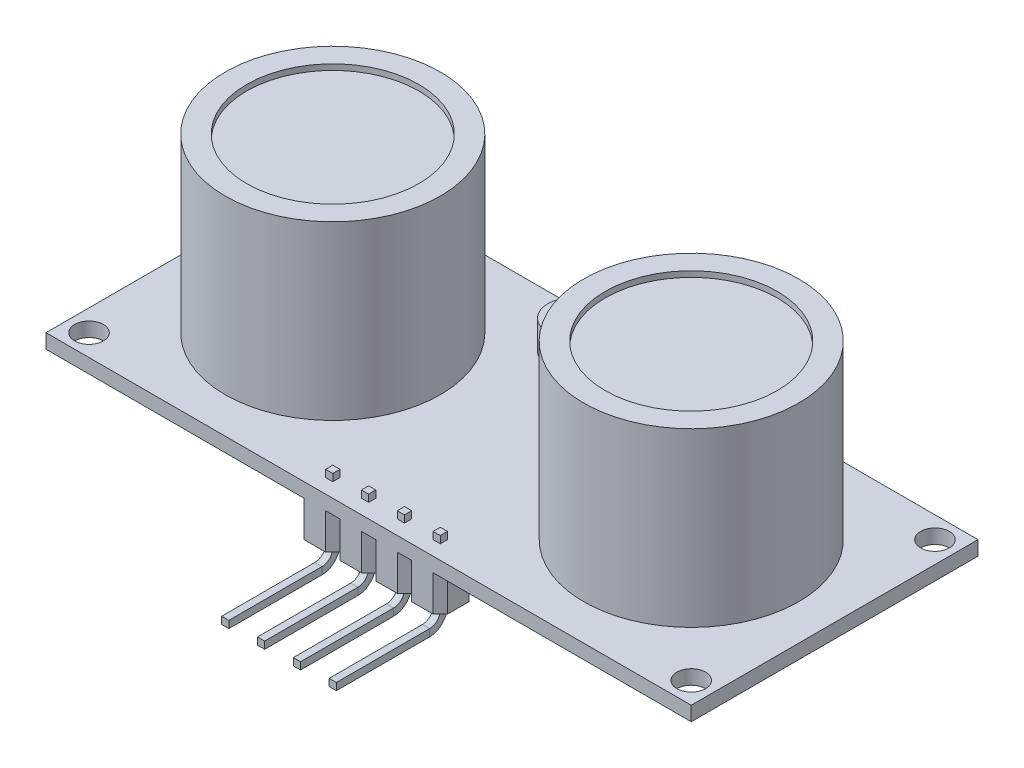
from build123d import *

# Parameters (mm, degrees)
SKETCH1_W           = 45
SKETCH1_H           = 20
BOSS_EXTRUDE1_DEPTH = 1
SKETCH2_R           = 7.5
SKETCH2_R_2         = 6
BOSS_EXTRUDE2_DEPTH = 12
BOSS_EXTRUDE3_DEPTH = 2
BOSS_EXTRUDE4_START = -0.5
SKETCH4_R           = 6
BOSS_EXTRUDE4_DEPTH = 0.1
SKETCH9_W           = 0.5
SKETCH9_H           = 0.5
SKETCH9_2_W         = 0.5
SKETCH9_2_H         = 0.5
BOSS_EXTRUDE7_DEPTH = 1.5
LPATTERN5_COUNT     = 4
LPATTERN5_PITCH     = 2.5
BOSS_EXTRUDE6_DEPTH = 2.5
SKETCH12_R          = 1
CUT_EXTRUDE4_DEPTH  = 1.5


with BuildPart() as part:
    # Sketch1 → Boss-Extrude1 (new body)
    with BuildSketch(Plane(origin=(0, 0, 0), x_dir=(1, 0, 0), z_dir=(0, 1, 0))):
        Rectangle(SKETCH1_W, SKETCH1_H)
    extrude(amount=BOSS_EXTRUDE1_DEPTH)

    # Sketch2 → Boss-Extrude2 (add)
    # profile 1 of 2: a face of its own
    with BuildSketch(Plane(origin=(0, 1, 0), x_dir=(1, 0, 0), z_dir=(0, 1, 0))):
        with Locations(Location((-12.5, 0, 0), (0, 0, 270))):
            Circle(SKETCH2_R)
        with Locations(Location((-12.5, 0, 0), (0, 0, 270))):
            Circle(SKETCH2_R_2, mode=Mode.SUBTRACT)
    # profile 2 of 2: a face of its own
    with BuildSketch(Plane(origin=(0, 1, 0), x_dir=(1, 0, 0), z_dir=(0, 1, 0))):
        with Locations(Location((12.5, 0, 0), (0, 0, 90))):
            Circle(SKETCH2_R)
        with Locations(Location((12.5, 0, 0), (0, 0, 90))):
            Circle(SKETCH2_R_2, mode=Mode.SUBTRACT)
    extrude(amount=BOSS_EXTRUDE2_DEPTH)

    # Sketch3 → Boss-Extrude3 (add)
    with BuildSketch(Plane(origin=(0, 1, 0), x_dir=(1, 0, 0), z_dir=(0, 1, 0))):
        with BuildLine():
            Line((-3, 9), (3, 9))
            ThreePointArc((3, 9), (4.75, 7.25), (3, 5.5))
            Line((3, 5.5), (-3, 5.5))
            ThreePointArc((-3, 5.5), (-4.75, 7.25), (-3, 9))
        make_face()
    extrude(amount=BOSS_EXTRUDE3_DEPTH)

    # Sketch4 → Boss-Extrude4 (add)
    with BuildSketch(Plane(origin=(0, 13, 0), x_dir=(1, 0, 0), z_dir=(0, 1, 0)).offset(BOSS_EXTRUDE4_START)):
        with Locations(Location((-12.5, 0, 0), (0, 0, 270))):
            Circle(SKETCH4_R)
        with Locations(Location((12.5, 0, 0), (0, 0, 90))):
            Circle(SKETCH4_R)
    extrude(amount=BOSS_EXTRUDE4_DEPTH)

    # Sweep1: sweep along a path in Sketch8
    with BuildLine(Plane(origin=(3.75, 0, 0), x_dir=(0, 0, -1), z_dir=(1, 0, 0))) as sweep1_path:
        Line((-8.75, 0), (-8.75, -3))
        ThreePointArc((-8.75, -3), (-9.042893219, -3.707106781), (-9.75, -4))
        Line((-9.75, -4), (-16.25, -4))
    # Sketch9 → Sweep1 (sweep)
    with BuildSketch(Plane.XZ):
        with Locations((3.75, 8.75)):
            Rectangle(SKETCH9_W, SKETCH9_H)
    sweep1 = sweep(path=sweep1_path.line)

    # Sketch9<2> → Boss-Extrude7 (add)
    with BuildSketch(Plane.XZ):
        with Locations((3.75, 8.75)):
            Rectangle(SKETCH9_2_W, SKETCH9_2_H)
    boss_extrude7 = extrude(amount=-BOSS_EXTRUDE7_DEPTH)

    # LPattern5: Sweep1, Boss-Extrude7 ×4
    with Locations(*[(-i * LPATTERN5_PITCH, 0, 0) for i in range(1, LPATTERN5_COUNT)]):
        add(sweep1)
        add(boss_extrude7)

    # Sketch11 → Boss-Extrude6 (add)
    with BuildSketch(Plane.XZ):
        Polygon((3, 7.5), (4.5, 7.5), (5, 8), (5, 9.5), (4.5, 10), (3, 10), (2.5, 9.5), (2, 10), (0.5, 10), (0, 9.5), (-0.5, 10), (-2, 10), (-2.5, 9.5), (-3, 10), (-4.5, 10), (-5, 9.5), (-5, 8), (-4.5, 7.5), (-3, 7.5), (-2.5, 8), (-2, 7.5), (-0.5, 7.5), (0, 8), (0.5, 7.5), (2, 7.5), (2.5, 8), align=None)
    extrude(amount=BOSS_EXTRUDE6_DEPTH)

    # Sketch12 → Cut-Extrude4 (cut)
    with BuildSketch(Plane.XZ):
        with Locations(Location((-21, 8.5, 0), (0, 0, 270))):
            Circle(SKETCH12_R)
        with Locations(Location((-21, -8.5, 0), (0, 0, 90))):
            Circle(SKETCH12_R)
        with Locations(Location((21, -8.5, 0), (0, 0, 270))):
            Circle(SKETCH12_R)
        with Locations(Location((21, 8.5, 0), (0, 0, 90))):
            Circle(SKETCH12_R)
    extrude(amount=-CUT_EXTRUDE4_DEPTH, mode=Mode.SUBTRACT)


solid = part.part
